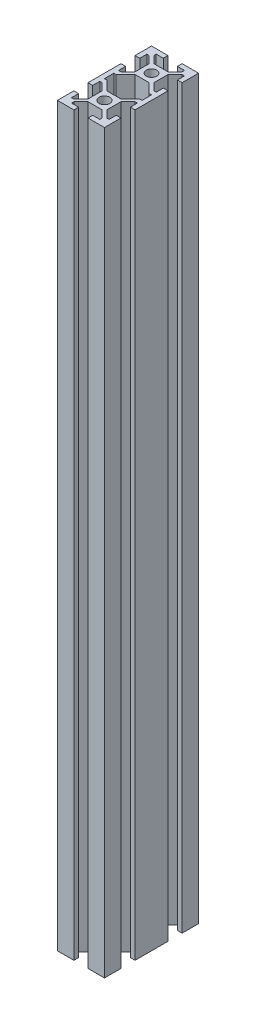
from build123d import *

# Parameters (mm, degrees)
SKETCH1_R           = 2.213186583
SKETCH1_R_2         = 2.28890728
BOSS_EXTRUDE1_DEPTH = 313


with BuildPart() as part:
    # Sketch1 → Boss-Extrude1 (new body)
    with BuildSketch(Plane(origin=(0, 0, 0), x_dir=(1, 0, 0), z_dir=(0, 1, 0))):
        Polygon((20, 0), (20, -7), (18, -7), (18, -4), (17, -4), (14, -7), (14, -13), (17, -16), (18, -16), (18, -13), (20, -13), (20, -27), (18, -27), (18, -24), (17, -24), (14, -27), (14, -33), (17, -36), (18, -36), (18, -33), (20, -33), (20, -40), (13, -40), (13, -38), (16, -38), (16, -37), (13, -34), (7, -34), (4, -37), (4, -38), (7, -38), (7, -40), (0, -40), (0, -33), (2, -33), (2, -36), (3, -36), (6, -33), (6, -27), (3, -24), (2, -24), (2, -27), (0, -27), (0, -13), (2, -13), (2, -16), (3, -16), (6, -13), (6, -7), (3, -4), (2, -4), (2, -7), (0, -7), (0, 0), (7, 0), (7, -2), (4, -2), (4, -3), (7, -6), (13, -6), (16, -3), (16, -2), (13, -2), (13, 0), align=None)
        with Locations(Location((10, -10, 0), (0, 0, 270))):
            Circle(SKETCH1_R, mode=Mode.SUBTRACT)
        with Locations(Location((10, -30, 0), (0, 0, 270))):
            Circle(SKETCH1_R_2, mode=Mode.SUBTRACT)
        Polygon((7, -14), (13, -14), (17, -18), (18, -18), (18, -22), (17, -22), (13, -26), (7, -26), (3, -22), (2, -22), (2, -18), (3, -18), align=None, mode=Mode.SUBTRACT)
    extrude(amount=BOSS_EXTRUDE1_DEPTH)


solid = part.part
